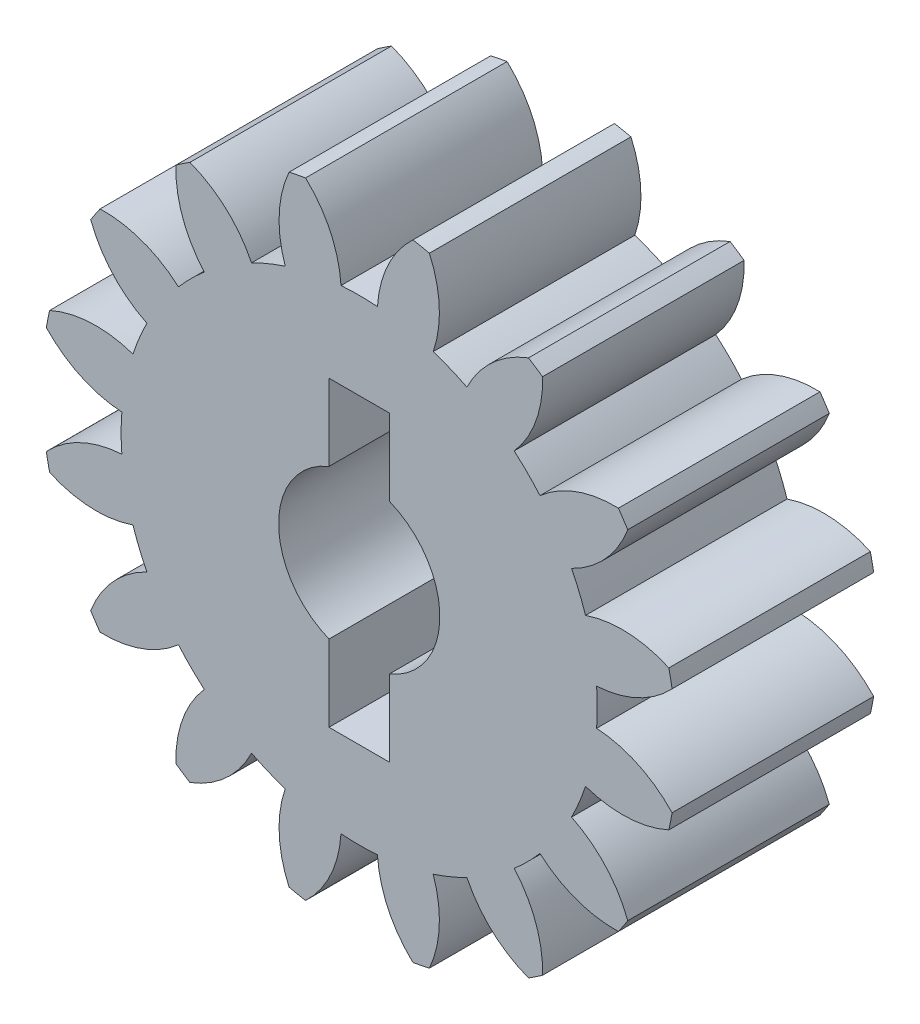
from build123d import *

# Parameters (mm, degrees)
BOSS_EXTRUDE1_DEPTH = 20


with BuildPart() as part:
    # Sketch1 → Boss-Extrude1 (new body)
    with BuildSketch(Plane.XY):
        with BuildLine():
            ThreePointArc((-31.046882255, 5.323636185), (-27.637166731, 2.849349951), (-23.55457664, 1.809777696))
            ThreePointArc((-23.55457664, 1.809777696), (-23.624, 0), (-23.55457664, -1.809777696))
            ThreePointArc((-23.55457664, -1.809777696), (-27.637166731, -2.849349951), (-31.046882255, -5.323636185))
            ThreePointArc((-31.046882255, -5.323636185), (-30.894736333, -6.145345143), (-30.720846432, -6.962728956))
            ThreePointArc((-30.720846432, -6.962728956), (-26.623811699, -7.943829725), (-22.454163195, -7.341929665))
            ThreePointArc((-22.454163195, -7.341929665), (-21.825730076, -9.040513406), (-21.069019314, -10.685962808))
            ThreePointArc((-21.069019314, -10.685962808), (-24.44301366, -13.208741926), (-26.646311696, -16.799525975))
            ThreePointArc((-26.646311696, -16.799525975), (-26.191292788, -17.50046234), (-25.717840224, -18.189081731))
            ThreePointArc((-25.717840224, -18.189081731), (-21.55722268, -17.527633336), (-17.935306952, -15.375894789))
            ThreePointArc((-17.935306952, -15.375894789), (-16.704690599, -16.704690599), (-15.375894789, -17.935306951))
            ThreePointArc((-15.375894789, -17.935306951), (-17.527633336, -21.55722268), (-18.189081731, -25.717840224))
            ThreePointArc((-18.189081731, -25.717840224), (-17.50046234, -26.191292788), (-16.799525975, -26.646311696))
            ThreePointArc((-16.799525975, -26.646311696), (-13.208741926, -24.44301366), (-10.685962808, -21.069019314))
            ThreePointArc((-10.685962808, -21.069019314), (-9.040513406, -21.825730076), (-7.341929665, -22.454163195))
            ThreePointArc((-7.341929665, -22.454163195), (-7.943829725, -26.623811699), (-6.962728956, -30.720846432))
            ThreePointArc((-6.962728956, -30.720846432), (-6.145345144, -30.894736333), (-5.323636185, -31.046882255))
            ThreePointArc((-5.323636185, -31.046882255), (-2.849349951, -27.637166731), (-1.809777696, -23.55457664))
            ThreePointArc((-1.809777696, -23.55457664), (0, -23.624), (1.809777696, -23.55457664))
            ThreePointArc((1.809777696, -23.55457664), (2.849349951, -27.637166731), (5.323636185, -31.046882255))
            ThreePointArc((5.323636185, -31.046882255), (6.145345143, -30.894736333), (6.962728956, -30.720846432))
            ThreePointArc((6.962728956, -30.720846432), (7.943829725, -26.623811699), (7.341929665, -22.454163195))
            ThreePointArc((7.341929665, -22.454163195), (9.040513406, -21.825730076), (10.685962808, -21.069019314))
            ThreePointArc((10.685962808, -21.069019314), (13.208741926, -24.44301366), (16.799525975, -26.646311696))
            ThreePointArc((16.799525975, -26.646311696), (17.50046234, -26.191292788), (18.189081731, -25.717840224))
            ThreePointArc((18.189081731, -25.717840224), (17.527633336, -21.55722268), (15.375894789, -17.935306952))
            ThreePointArc((15.375894789, -17.935306952), (16.704690599, -16.704690599), (17.935306952, -15.375894789))
            ThreePointArc((17.935306952, -15.375894789), (21.55722268, -17.527633336), (25.717840224, -18.189081731))
            ThreePointArc((25.717840224, -18.189081731), (26.191292788, -17.50046234), (26.646311696, -16.799525975))
            ThreePointArc((26.646311696, -16.799525975), (24.44301366, -13.208741926), (21.069019314, -10.685962808))
            ThreePointArc((21.069019314, -10.685962808), (21.825730076, -9.040513406), (22.454163195, -7.341929665))
            ThreePointArc((22.454163195, -7.341929665), (26.623811699, -7.943829725), (30.720846432, -6.962728956))
            ThreePointArc((30.720846432, -6.962728956), (30.894736333, -6.145345144), (31.046882255, -5.323636185))
            ThreePointArc((31.046882255, -5.323636185), (27.637166731, -2.849349951), (23.55457664, -1.809777696))
            ThreePointArc((23.55457664, -1.809777696), (23.624, 0), (23.55457664, 1.809777696))
            ThreePointArc((23.55457664, 1.809777696), (27.637166731, 2.849349951), (31.046882255, 5.323636185))
            ThreePointArc((31.046882255, 5.323636185), (30.894736333, 6.145345144), (30.720846432, 6.962728956))
            ThreePointArc((30.720846432, 6.962728956), (26.623811699, 7.943829725), (22.454163195, 7.341929665))
            ThreePointArc((22.454163195, 7.341929665), (21.825730076, 9.040513406), (21.069019314, 10.685962808))
            ThreePointArc((21.069019314, 10.685962808), (24.44301366, 13.208741926), (26.646311696, 16.799525975))
            ThreePointArc((26.646311696, 16.799525975), (26.191292788, 17.50046234), (25.717840224, 18.189081731))
            ThreePointArc((25.717840224, 18.189081731), (21.55722268, 17.527633336), (17.935306951, 15.375894789))
            ThreePointArc((17.935306951, 15.375894789), (16.704690599, 16.704690599), (15.375894789, 17.935306952))
            ThreePointArc((15.375894789, 17.935306952), (17.527633336, 21.55722268), (18.189081731, 25.717840224))
            ThreePointArc((18.189081731, 25.717840224), (17.50046234, 26.191292788), (16.799525975, 26.646311696))
            ThreePointArc((16.799525975, 26.646311696), (13.208741926, 24.44301366), (10.685962808, 21.069019314))
            ThreePointArc((10.685962808, 21.069019314), (9.040513406, 21.825730076), (7.341929665, 22.454163195))
            ThreePointArc((7.341929665, 22.454163195), (7.943829725, 26.623811699), (6.962728956, 30.720846432))
            ThreePointArc((6.962728956, 30.720846432), (6.145345144, 30.894736333), (5.323636185, 31.046882255))
            ThreePointArc((5.323636185, 31.046882255), (2.849349951, 27.637166731), (1.809777696, 23.55457664))
            ThreePointArc((1.809777696, 23.55457664), (0, 23.624), (-1.809777696, 23.55457664))
            ThreePointArc((-1.809777696, 23.55457664), (-2.849349951, 27.637166731), (-5.323636185, 31.046882255))
            ThreePointArc((-5.323636185, 31.046882255), (-6.145345144, 30.894736333), (-6.962728956, 30.720846432))
            ThreePointArc((-6.962728956, 30.720846432), (-7.943829725, 26.623811699), (-7.341929665, 22.454163195))
            ThreePointArc((-7.341929665, 22.454163195), (-9.040513406, 21.825730076), (-10.685962808, 21.069019314))
            ThreePointArc((-10.685962808, 21.069019314), (-13.208741926, 24.44301366), (-16.799525975, 26.646311696))
            ThreePointArc((-16.799525975, 26.646311696), (-17.50046234, 26.191292788), (-18.189081731, 25.717840224))
            ThreePointArc((-18.189081731, 25.717840224), (-17.527633336, 21.55722268), (-15.375894789, 17.935306952))
            ThreePointArc((-15.375894789, 17.935306952), (-16.704690599, 16.704690599), (-17.935306952, 15.375894789))
            ThreePointArc((-17.935306952, 15.375894789), (-21.55722268, 17.527633336), (-25.717840224, 18.189081731))
            ThreePointArc((-25.717840224, 18.189081731), (-26.191292788, 17.50046234), (-26.646311696, 16.799525975))
            ThreePointArc((-26.646311696, 16.799525975), (-24.44301366, 13.208741926), (-21.069019314, 10.685962808))
            ThreePointArc((-21.069019314, 10.685962808), (-21.825730076, 9.040513406), (-22.454163195, 7.341929665))
            ThreePointArc((-22.454163195, 7.341929665), (-26.623811699, 7.943829725), (-30.720846432, 6.962728956))
            ThreePointArc((-30.720846432, 6.962728956), (-30.894736333, 6.145345144), (-31.046882255, 5.323636185))
        make_face()
        with BuildLine():
            Line((-3, 15), (3, 15))
            Line((3, 15), (3, 7.416198487))
            ThreePointArc((3, 7.416198487), (8, 0), (3, -7.416198487))
            Line((3, -7.416198487), (3, -15))
            Line((3, -15), (-3, -15))
            Line((-3, -15), (-3, -7.416198487))
            ThreePointArc((-3, -7.416198487), (-8, 0), (-3, 7.416198487))
            Line((-3, 7.416198487), (-3, 15))
        make_face(mode=Mode.SUBTRACT)
    extrude(amount=BOSS_EXTRUDE1_DEPTH)


solid = part.part
